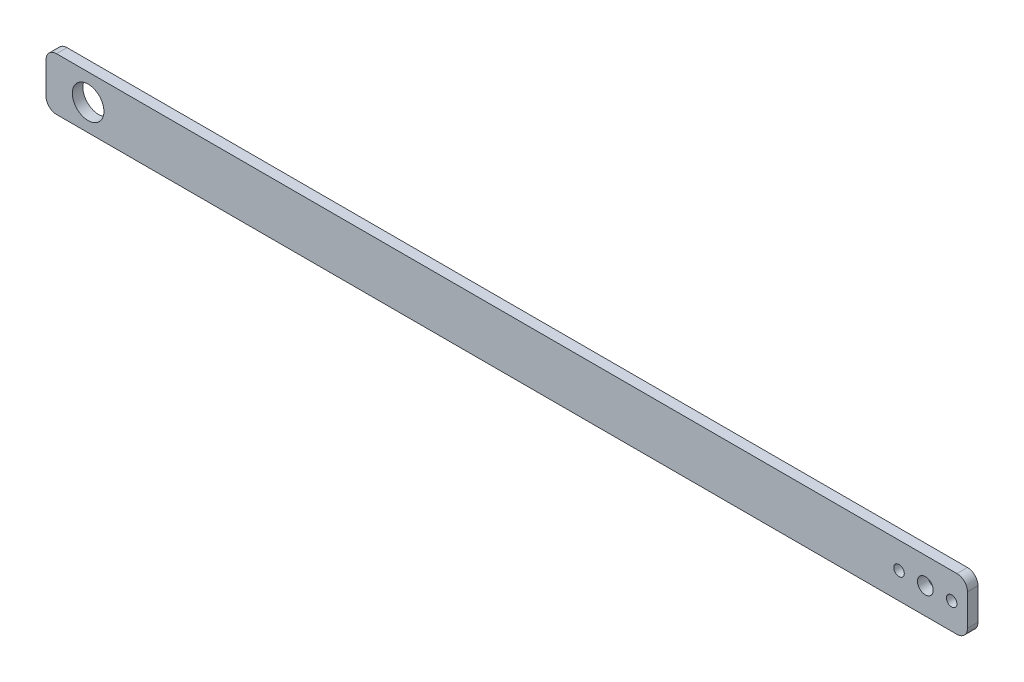
from build123d import *

# Parameters (mm, degrees)
SKETCH_1_W               = 175
SKETCH_1_H               = 10
EXTRUDE_1_DEPTH          = 2
CUT_EXTRUDE_1_DEPTH      = 12
CUT_EXTRUDE_1_DEPTH_BACK = 15
SKETCH_2_R               = 3
SKETCH_3_R               = 1.5
SKETCH_3_R_2             = 1
CUT_EXTRUDE_2_DEPTH      = 10
FILLET_1_R               = 2


with BuildPart() as part:
    # 草图1 → 凸台-拉伸1 (new body)
    with BuildSketch(Plane.XY):
        with Locations((-82.5, -5)):
            Rectangle(SKETCH_1_W, SKETCH_1_H)
    extrude(amount=EXTRUDE_1_DEPTH)

    # 草图2 → 切除-拉伸1 (cut, two sides: drawn at the far end of the back side and taken through both)
    with BuildSketch(Plane.XY.offset(2).offset(-CUT_EXTRUDE_1_DEPTH_BACK)):
        with Locations((-162, -5)):
            Circle(SKETCH_2_R)
    extrude(amount=CUT_EXTRUDE_1_DEPTH + CUT_EXTRUDE_1_DEPTH_BACK, mode=Mode.SUBTRACT)

    # 草图3 → 切除-拉伸2 (cut)
    with BuildSketch(Plane.XY.offset(2)):
        with Locations((-3, -5)):
            Circle(SKETCH_3_R)
        with Locations((-8, -5)):
            Circle(SKETCH_3_R_2)
        with Locations((2, -5)):
            Circle(SKETCH_3_R_2)
    extrude(amount=-CUT_EXTRUDE_2_DEPTH, mode=Mode.SUBTRACT)

    # 圆角1
    fillet_1_edges = [part.edges().sort_by_distance(p)[0] for p in [
        (-170, 0, 1),
        (5, 0, 1),
        (5, -10, 1),
        (-170, -10, 1),
    ]]
    fillet(fillet_1_edges, radius=FILLET_1_R)


solid = part.part
